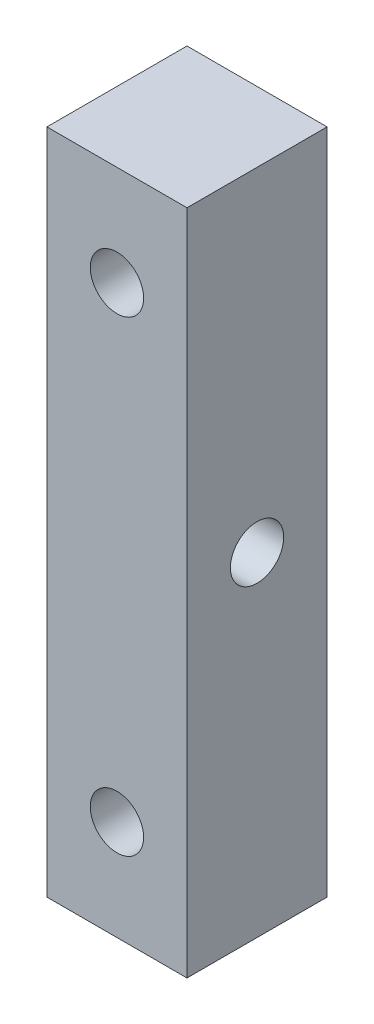
from build123d import *

# Parameters (mm, degrees)
SKETCH1_W           = 21
SKETCH1_H           = 21
BOSS_EXTRUDE1_DEPTH = 100
SKETCH2_R           = 4
CUT_EXTRUDE1_DEPTH  = 103.719277645
SKETCH4_R           = 4
CUT_EXTRUDE2_DEPTH  = 103.719277645


with BuildPart() as part:
    # Sketch1 → Boss-Extrude1 (new body)
    with BuildSketch(Plane(origin=(0, 0, 0), x_dir=(1, 0, 0), z_dir=(0, 1, 0))):
        Rectangle(SKETCH1_W, SKETCH1_H)
    extrude(amount=BOSS_EXTRUDE1_DEPTH)

    # Sketch2 → Cut-Extrude1 (cut, through all)
    with BuildSketch(Plane.XY.offset(10.5)):
        with Locations((0, 85)):
            Circle(SKETCH2_R)
        with Locations((0, 15)):
            Circle(SKETCH2_R)
    extrude(amount=-CUT_EXTRUDE1_DEPTH, mode=Mode.SUBTRACT)

    # Sketch4 → Cut-Extrude2 (cut, through all)
    with BuildSketch(Plane(origin=(10.5, 0, 0), x_dir=(0, 0, -1), z_dir=(1, 0, 0))):
        with Locations((0, 50)):
            Circle(SKETCH4_R)
    extrude(amount=-CUT_EXTRUDE2_DEPTH, mode=Mode.SUBTRACT)


solid = part.part
